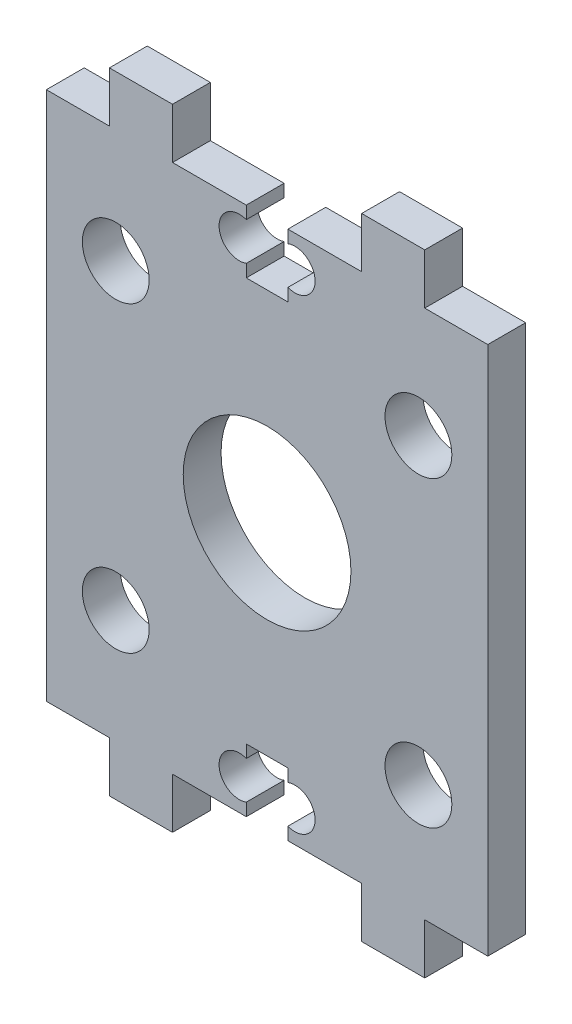
from build123d import *

# Parameters (mm, degrees)
SKETCH_1_R      = 6.65
SKETCH_1_R_2    = 2.65
EXTRUDE_1_DEPTH = 3


with BuildPart() as part:
    # 草图1 → 凸台-拉伸1 (new body)
    with BuildSketch(Plane.XY):
        with BuildLine():
            Line((17.5, -21), (17.5, 21))
            Line((17.5, 21), (12.5, 21))
            Line((12.5, 21), (12.5, 25))
            Line((12.5, 25), (7.5, 25))
            Line((7.5, 25), (7.5, 21))
            Line((7.5, 21), (1.65, 21))
            Line((1.65, 21), (1.65, 20))
            ThreePointArc((1.65, 20), (3.806776436, 18.5), (1.65, 17))
            Line((1.65, 17), (1.65, 16))
            Line((1.65, 16), (-1.65, 16))
            Line((-1.65, 16), (-1.65, 17))
            ThreePointArc((-1.65, 17), (-3.806776436, 18.5), (-1.65, 20))
            Line((-1.65, 20), (-1.65, 21))
            Line((-1.65, 21), (-7.5, 21))
            Line((-7.5, 21), (-7.5, 25))
            Line((-7.5, 25), (-12.5, 25))
            Line((-12.5, 25), (-12.5, 21))
            Line((-12.5, 21), (-17.5, 21))
            Line((-17.5, 21), (-17.5, -21))
            Line((-17.5, -21), (-12.5, -21))
            Line((-12.5, -21), (-12.5, -25))
            Line((-12.5, -25), (-7.5, -25))
            Line((-7.5, -25), (-7.5, -21))
            Line((-7.5, -21), (-1.65, -21))
            Line((-1.65, -21), (-1.65, -20))
            ThreePointArc((-1.65, -20), (-3.806776436, -18.5), (-1.65, -17))
            Line((-1.65, -17), (-1.65, -16))
            Line((-1.65, -16), (1.65, -16))
            Line((1.65, -16), (1.65, -17))
            ThreePointArc((1.65, -17), (3.806776436, -18.5), (1.65, -20))
            Line((1.65, -20), (1.65, -21))
            Line((1.65, -21), (7.5, -21))
            Line((7.5, -21), (7.5, -25))
            Line((7.5, -25), (12.5, -25))
            Line((12.5, -25), (12.5, -21))
            Line((12.5, -21), (17.5, -21))
        make_face()
        Circle(SKETCH_1_R, mode=Mode.SUBTRACT)
        with Locations((11.999602077, -11.999602077)):
            Circle(SKETCH_1_R_2, mode=Mode.SUBTRACT)
        with Locations((-11.999602077, -11.999602077)):
            Circle(SKETCH_1_R_2, mode=Mode.SUBTRACT)
        with Locations((-11.999602077, 11.999602077)):
            Circle(SKETCH_1_R_2, mode=Mode.SUBTRACT)
        with Locations((11.999602077, 11.999602077)):
            Circle(SKETCH_1_R_2, mode=Mode.SUBTRACT)
    extrude(amount=EXTRUDE_1_DEPTH)


solid = part.part
